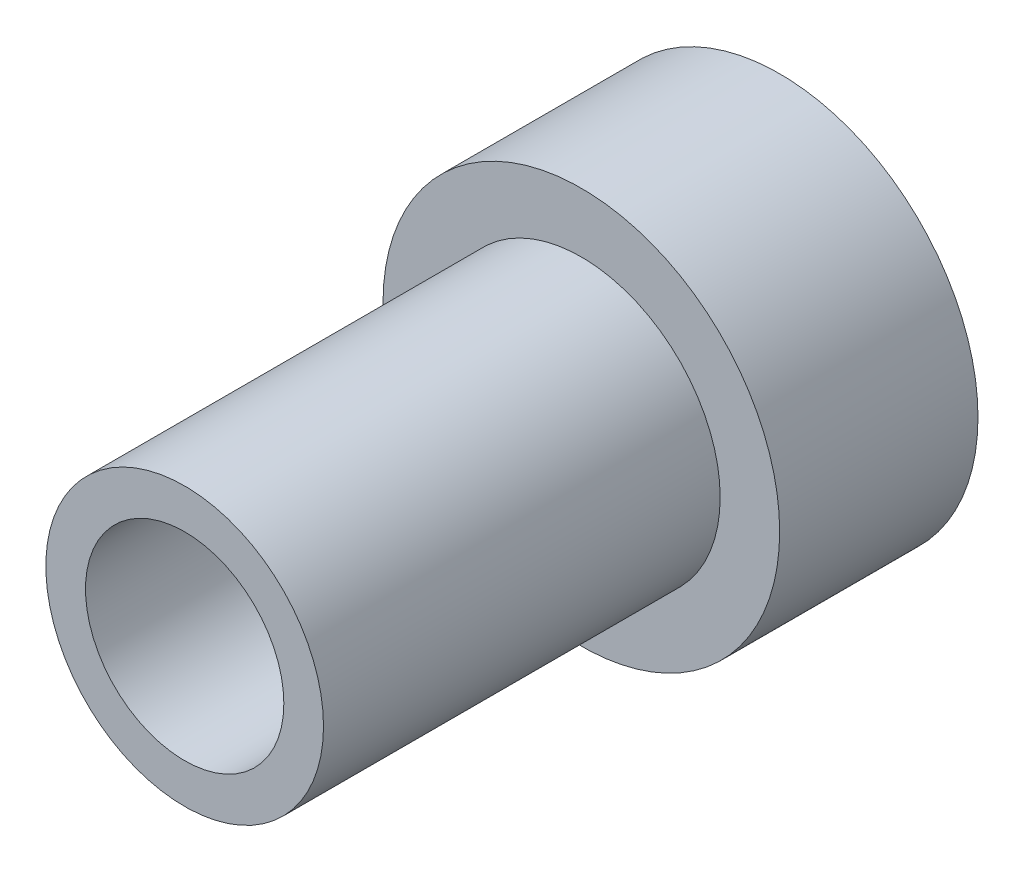
from build123d import *

# Parameters (mm, degrees)
SKETCH1_R           = 5
BOSS_EXTRUDE1_DEPTH = 5
SKETCH2_R           = 3.5
BOSS_EXTRUDE2_DEPTH = 10
SKETCH3_R           = 2.5
CUT_EXTRUDE1_DEPTH  = 17.583123952


with BuildPart() as part:
    # Sketch1 → Boss-Extrude1 (new body)
    with BuildSketch(Plane.XY):
        Circle(SKETCH1_R)
    extrude(amount=BOSS_EXTRUDE1_DEPTH)

    # Sketch2 → Boss-Extrude2 (add)
    with BuildSketch(Plane.XY.offset(5)):
        Circle(SKETCH2_R)
    extrude(amount=BOSS_EXTRUDE2_DEPTH)

    # Sketch3 → Cut-Extrude1 (cut, through all)
    with BuildSketch(Plane.XY.offset(15)):
        Circle(SKETCH3_R)
    extrude(amount=-CUT_EXTRUDE1_DEPTH, mode=Mode.SUBTRACT)


solid = part.part
